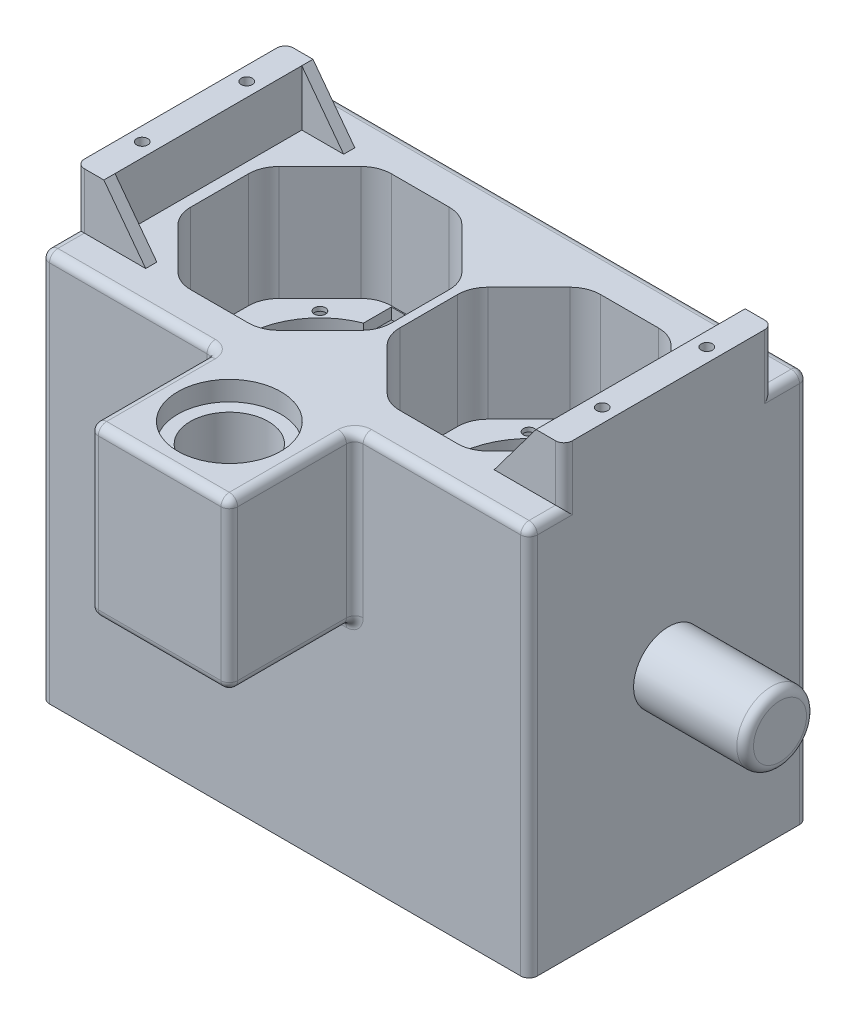
from build123d import *

# Parameters (mm, degrees)
SKETCH1_W           = 175
SKETCH1_H           = 100
BOSS_EXTRUDE1_DEPTH = 45
CUT_EXTRUDE1_DEPTH  = 41
CUT_EXTRUDE2_DEPTH  = 111.368700273
SKETCH4_W           = 175
SKETCH4_H           = 100
SKETCH4_W_2         = 155
SKETCH4_H_2         = 80
BOSS_EXTRUDE2_DEPTH = 95
SKETCH5_R           = 2.5
CUT_EXTRUDE3_DEPTH  = 5
SKETCH6_R           = 2
CUT_EXTRUDE4_DEPTH  = 15
CUT_EXTRUDE8_DEPTH  = 2.5
SKETCH12_R          = 2
CUT_EXTRUDE9_DEPTH  = 139.496389845
SKETCH13_R          = 3
CUT_EXTRUDE10_DEPTH = 10
CUT_EXTRUDE11_DEPTH = 4
SKETCH17_R          = 12.5
BOSS_EXTRUDE5_DEPTH = 40
SKETCH18_W          = 50
SKETCH18_H          = 45
BOSS_EXTRUDE6_DEPTH = 60
SKETCH19_R          = 18.5
CUT_EXTRUDE12_DEPTH = 7
SKETCH20_R          = 14
CUT_EXTRUDE15_DEPTH = 25
SKETCH21_W          = 10
SKETCH21_H          = 75
BOSS_EXTRUDE7_DEPTH = 20
SKETCH23_R          = 2
CUT_EXTRUDE16_DEPTH = 15
BOSS_EXTRUDE9_DEPTH = 4
FILLET1_R           = 3


with BuildPart() as part:
    # Sketch1 → Boss-Extrude1 (new body)
    with BuildSketch(Plane(origin=(0, 0, 0), x_dir=(1, 0, 0), z_dir=(0, 1, 0))):
        Rectangle(SKETCH1_W, SKETCH1_H)
    extrude(amount=BOSS_EXTRUDE1_DEPTH)

    # Sketch2 → Cut-Extrude1 (cut)
    with BuildSketch(Plane(origin=(0, 45, 0), x_dir=(1, 0, 0), z_dir=(0, 1, 0))):
        with BuildLine():
            Line((-19.366486348, -32.778174593), (-4.721825407, -18.133513652))
            ThreePointArc((-4.721825407, -18.133513652), (-2.337325142, -14.564856815), (-1.5, -10.355339059))
            Line((-1.5, -10.355339059), (-1.5, 10.355339059))
            ThreePointArc((-1.5, 10.355339059), (-2.337325142, 14.564856815), (-4.721825407, 18.133513652))
            Line((-4.721825407, 18.133513652), (-19.366486348, 32.778174593))
            ThreePointArc((-19.366486348, 32.778174593), (-22.935143185, 35.162674858), (-27.144660941, 36))
            Line((-27.144660941, 36), (-47.855339059, 36))
            ThreePointArc((-47.855339059, 36), (-52.064856815, 35.162674858), (-55.633513652, 32.778174593))
            Line((-55.633513652, 32.778174593), (-70.278174593, 18.133513652))
            ThreePointArc((-70.278174593, 18.133513652), (-72.662674858, 14.564856815), (-73.5, 10.355339059))
            Line((-73.5, 10.355339059), (-73.5, -10.355339059))
            ThreePointArc((-73.5, -10.355339059), (-72.662674858, -14.564856815), (-70.278174593, -18.133513652))
            Line((-70.278174593, -18.133513652), (-55.633513652, -32.778174593))
            ThreePointArc((-55.633513652, -32.778174593), (-52.064856815, -35.162674858), (-47.855339059, -36))
            Line((-47.855339059, -36), (-27.144660941, -36))
            ThreePointArc((-27.144660941, -36), (-22.935143185, -35.162674858), (-19.366486348, -32.778174593))
        make_face()
        with BuildLine():
            Line((55.633513652, -32.778174593), (70.278174593, -18.133513652))
            ThreePointArc((70.278174593, -18.133513652), (72.662674858, -14.564856815), (73.5, -10.355339059))
            Line((73.5, -10.355339059), (73.5, 10.355339059))
            ThreePointArc((73.5, 10.355339059), (72.662674858, 14.564856815), (70.278174593, 18.133513652))
            Line((70.278174593, 18.133513652), (55.633513652, 32.778174593))
            ThreePointArc((55.633513652, 32.778174593), (52.064856815, 35.162674858), (47.855339059, 36))
            Line((47.855339059, 36), (27.144660941, 36))
            ThreePointArc((27.144660941, 36), (22.935143185, 35.162674858), (19.366486348, 32.778174593))
            Line((19.366486348, 32.778174593), (4.721825407, 18.133513652))
            ThreePointArc((4.721825407, 18.133513652), (2.337325142, 14.564856815), (1.5, 10.355339059))
            Line((1.5, 10.355339059), (1.5, -10.355339059))
            ThreePointArc((1.5, -10.355339059), (2.337325142, -14.564856815), (4.721825407, -18.133513652))
            Line((4.721825407, -18.133513652), (19.366486348, -32.778174593))
            ThreePointArc((19.366486348, -32.778174593), (22.935143185, -35.162674858), (27.144660941, -36))
            Line((27.144660941, -36), (47.855339059, -36))
            ThreePointArc((47.855339059, -36), (52.064856815, -35.162674858), (55.633513652, -32.778174593))
        make_face()
    extrude(amount=-CUT_EXTRUDE1_DEPTH, mode=Mode.SUBTRACT)

    # Sketch3 → Cut-Extrude2 (cut, through all)
    with BuildSketch(Plane(origin=(0, 45, 0), x_dir=(1, 0, 0), z_dir=(0, 1, 0))):
        with BuildLine():
            Line((-27.5, 35.617376915), (-47.5, 35.617376915))
            Line((-47.5, 35.617376915), (-47.5, 25.617376915))
            ThreePointArc((-47.5, 25.617376915), (-37.5, -27.5), (-27.5, 25.617376915))
            Line((-27.5, 25.617376915), (-27.5, 35.617376915))
        make_face()
        with BuildLine():
            Line((47.5, 35.617376915), (27.5, 35.617376915))
            Line((27.5, 35.617376915), (27.5, 25.617376915))
            ThreePointArc((27.5, 25.617376915), (37.5, -27.5), (47.5, 25.617376915))
            Line((47.5, 25.617376915), (47.5, 35.617376915))
        make_face()
    extrude(amount=-CUT_EXTRUDE2_DEPTH, mode=Mode.SUBTRACT)

    # Sketch4 → Boss-Extrude2 (add)
    with BuildSketch(Plane.XZ):
        Rectangle(SKETCH4_W, SKETCH4_H)
        Rectangle(SKETCH4_W_2, SKETCH4_H_2, mode=Mode.SUBTRACT)
    extrude(amount=BOSS_EXTRUDE2_DEPTH)

    # Sketch5 → Cut-Extrude3 (cut)
    with BuildSketch(Plane.XZ.offset(95)):
        with Locations(Location((-82.5, 45, 0), (0, 0, 270))):
            Circle(SKETCH5_R)
        with Locations(Location((82.5, 45, 0), (0, 0, 90))):
            Circle(SKETCH5_R)
        with Locations(Location((82.5, -45, 0), (0, 0, 270))):
            Circle(SKETCH5_R)
        with Locations(Location((-82.5, -45, 0), (0, 0, 90))):
            Circle(SKETCH5_R)
    extrude(amount=-CUT_EXTRUDE3_DEPTH, mode=Mode.SUBTRACT)

    # Sketch6 → Cut-Extrude4 (cut)
    with BuildSketch(Plane.XZ.offset(95)):
        with Locations(Location((-82.5, 45, 0), (0, 0, 270))):
            Circle(SKETCH6_R)
        with Locations(Location((82.5, 45, 0), (0, 0, 90))):
            Circle(SKETCH6_R)
        with Locations(Location((82.5, -45, 0), (0, 0, 270))):
            Circle(SKETCH6_R)
        with Locations(Location((-82.5, -45, 0), (0, 0, 90))):
            Circle(SKETCH6_R)
    extrude(amount=-CUT_EXTRUDE4_DEPTH, mode=Mode.SUBTRACT)

    # Sketch11 → Cut-Extrude8 (cut)
    with BuildSketch(Plane.XZ):
        Polygon((-12.866016727, 22.388617676), (-15.111382324, 24.633983273), (-18.178608771, 23.812122424), (-19.000469621, 20.744895977), (-16.755104023, 18.499530379), (-13.687877576, 19.321391229), align=None)
        Polygon((-59.888617676, 24.633983273), (-62.133983273, 22.388617676), (-61.312122424, 19.321391229), (-58.244895977, 18.499530379), (-55.999530379, 20.744895977), (-56.821391229, 23.812122424), align=None)
        Polygon((-15.111382324, -24.633983273), (-12.866016727, -22.388617676), (-13.687877576, -19.321391229), (-16.755104023, -18.499530379), (-19.000469621, -20.744895977), (-18.178608771, -23.812122424), align=None)
        Polygon((-62.133983273, -22.388617676), (-59.888617676, -24.633983273), (-56.821391229, -23.812122424), (-55.999530379, -20.744895977), (-58.244895977, -18.499530379), (-61.312122424, -19.321391229), align=None)
        Polygon((61.312122424, -19.321391229), (62.133983273, -22.388617676), (59.888617676, -24.633983273), (56.821391229, -23.812122424), (55.999530379, -20.744895977), (58.244895977, -18.499530379), align=None)
        Polygon((18.178608771, -23.812122424), (15.111382324, -24.633983273), (12.866016727, -22.388617676), (13.687877576, -19.321391229), (16.755104023, -18.499530379), (19.000469621, -20.744895977), align=None)
        Polygon((13.687877576, 19.321391229), (12.866016727, 22.388617676), (15.111382324, 24.633983273), (18.178608771, 23.812122424), (19.000469621, 20.744895977), (16.755104023, 18.499530379), align=None)
        Polygon((56.821391229, 23.812122424), (59.888617676, 24.633983273), (62.133983273, 22.388617676), (61.312122424, 19.321391229), (58.244895977, 18.499530379), (55.999530379, 20.744895977), align=None)
    extrude(amount=-CUT_EXTRUDE8_DEPTH, mode=Mode.SUBTRACT)

    # Sketch12 → Cut-Extrude9 (cut, through all)
    with BuildSketch(Plane.XZ):
        with Locations(Location((-59.066756826, 21.566756826, 0), (0, 0, 270))):
            Circle(SKETCH12_R)
        with Locations(Location((-15.933243174, 21.566756826, 0), (0, 0, 270))):
            Circle(SKETCH12_R)
        with Locations(Location((-15.933243174, -21.566756826, 0), (0, 0, 270))):
            Circle(SKETCH12_R)
        with Locations(Location((-59.066756826, -21.566756826, 0), (0, 0, 270))):
            Circle(SKETCH12_R)
        with Locations(Location((59.066756826, -21.566756826, 0), (0, 0, 270))):
            Circle(SKETCH12_R)
        with Locations(Location((15.933243174, -21.566756826, 0), (0, 0, 270))):
            Circle(SKETCH12_R)
        with Locations(Location((15.933243174, 21.566756826, 0), (0, 0, 270))):
            Circle(SKETCH12_R)
        with Locations(Location((59.066756826, 21.566756826, 0), (0, 0, 270))):
            Circle(SKETCH12_R)
    extrude(amount=-CUT_EXTRUDE9_DEPTH, mode=Mode.SUBTRACT)

    # Sketch13 → Cut-Extrude10 (cut)
    with BuildSketch(Plane.ZY.offset(87.5)):
        with Locations((-28.284271247, -12.5)):
            Circle(SKETCH13_R)
        with Locations(Location((-28.284271247, -32.5, 0), (0, 0, 180))):
            Circle(SKETCH13_R)
    extrude(amount=-CUT_EXTRUDE10_DEPTH, mode=Mode.SUBTRACT)

    # Sketch16 → Cut-Extrude11 (cut)
    with BuildSketch(Plane(origin=(-77.5, 0, 0), x_dir=(0, 0, -1), z_dir=(1, 0, 0))):
        Polygon((28.284271247, -7.881197846), (24.284271247, -10.190598923), (24.284271247, -14.809401077), (28.284271247, -17.118802154), (32.284271247, -14.809401077), (32.284271247, -10.190598923), align=None)
        Polygon((28.284271247, -27.881197846), (24.284271247, -30.190598923), (24.284271247, -34.809401077), (28.284271247, -37.118802154), (32.284271247, -34.809401077), (32.284271247, -30.190598923), align=None)
    extrude(amount=-CUT_EXTRUDE11_DEPTH, mode=Mode.SUBTRACT)

    # Sketch17 → Boss-Extrude5 (add)
    with BuildSketch(Plane(origin=(87.5, 0, 0), x_dir=(0, 0, -1), z_dir=(1, 0, 0))):
        with Locations((0, -22.5)):
            Circle(SKETCH17_R)
    extrude(amount=BOSS_EXTRUDE5_DEPTH)

    # Sketch18 → Boss-Extrude6 (add)
    with BuildSketch(Plane(origin=(0, 45, 0), x_dir=(1, 0, 0), z_dir=(0, 1, 0))):
        with Locations((0, -72.5)):
            Rectangle(SKETCH18_W, SKETCH18_H)
    extrude(amount=-BOSS_EXTRUDE6_DEPTH)

    # Sketch19 → Cut-Extrude12 (cut)
    with BuildSketch(Plane(origin=(0, 45, 0), x_dir=(1, 0, 0), z_dir=(0, 1, 0))):
        with Locations(Location((0, -70, 0), (0, 0, 270))):
            Circle(SKETCH19_R)
    extrude(amount=-CUT_EXTRUDE12_DEPTH, mode=Mode.SUBTRACT)

    # Sketch20 → Cut-Extrude15 (cut)
    with BuildSketch(Plane(origin=(0, 45, 0), x_dir=(1, 0, 0), z_dir=(0, 1, 0))):
        with Locations(Location((0, -70, 0), (0, 0, 270))):
            Circle(SKETCH20_R)
    extrude(amount=-CUT_EXTRUDE15_DEPTH, mode=Mode.SUBTRACT)

    # Sketch21 → Boss-Extrude7 (add)
    with BuildSketch(Plane(origin=(0, 45, 0), x_dir=(1, 0, 0), z_dir=(0, 1, 0))):
        with Locations((-82.5, 0)):
            Rectangle(SKETCH21_W, SKETCH21_H)
        with Locations((82.5, 0)):
            Rectangle(SKETCH21_W, SKETCH21_H)
    extrude(amount=BOSS_EXTRUDE7_DEPTH)

    # Sketch23 → Cut-Extrude16 (cut)
    with BuildSketch(Plane(origin=(0, 65, 0), x_dir=(1, 0, 0), z_dir=(0, 1, 0))):
        with Locations(Location((-82.5, 18.75, 0), (0, 0, 270))):
            Circle(SKETCH23_R)
        with Locations(Location((-82.5, -18.75, 0), (0, 0, 90))):
            Circle(SKETCH23_R)
        with Locations(Location((82.5, -18.75, 0), (0, 0, 270))):
            Circle(SKETCH23_R)
        with Locations(Location((82.5, 18.75, 0), (0, 0, 90))):
            Circle(SKETCH23_R)
    extrude(amount=-CUT_EXTRUDE16_DEPTH, mode=Mode.SUBTRACT)

    # Sketch26 → Boss-Extrude9 (add)
    with BuildSketch(Plane.XY.offset(37.5)):
        Polygon((-77.5, 65), (-77.5, 45), (-62.5, 45), align=None)
        Polygon((77.5, 45), (62.5, 45), (77.5, 65), align=None)
    boss_extrude9 = extrude(amount=-BOSS_EXTRUDE9_DEPTH)

    # Mirror1: Boss-Extrude9 across plane
    add(boss_extrude9.mirror(Plane.XY))

    # Fillet1
    fillet1_edges = [part.edges().sort_by_distance(p)[0] for p in [
        (-87.5, 45, -43.75),
        (-56.25, 45, 50),
        (127.5, -22.5, 12.5),
        (56.25, 45, 50),
        (25, -15, 72.5),
        (25, 15, 50),
        (0, -15, 95),
        (25, 15, 95),
        (-25, -15, 72.5),
        (-25, 15, 95),
        (0, -15, 50),
        (-25, 15, 50),
        (25, 45, 72.5),
        (-25, 45, 72.5),
        (0, 45, 95),
        (-87.5, 45, 43.75),
        (-87.5, 55, -37.5),
        (-87.5, 55, 37.5),
        (87.5, 45, -43.75),
        (87.5, 55, 37.5),
        (87.5, 55, -37.5),
        (87.5, 45, 43.75),
        (87.5, -25, 50),
        (-87.5, -25, 50),
        (-87.5, -25, -50),
        (87.5, -25, -50),
        (0, 45, -50),
    ]]
    fillet(fillet1_edges, radius=FILLET1_R)


solid = part.part
